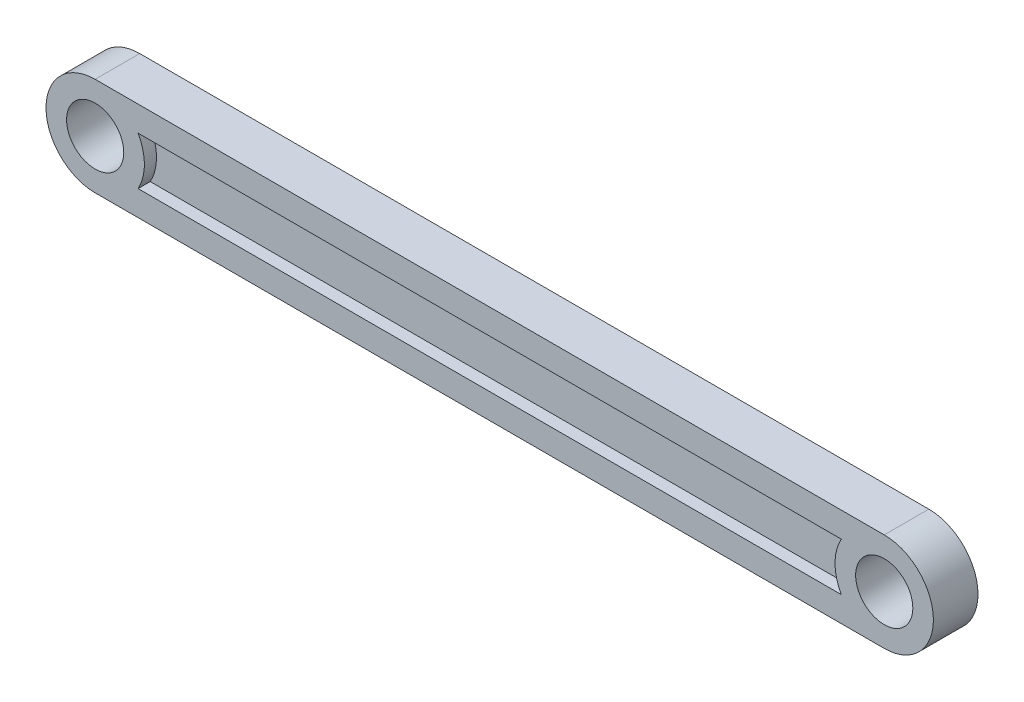
from build123d import *

# Parameters (mm, degrees)
SKETCH1_R           = 2.5
BOSS_EXTRUDE1_DEPTH = 1.95
CUT_EXTRUDE1_DEPTH  = 1.06


with BuildPart() as part:
    # Sketch1 → Boss-Extrude1 (new, symmetric)
    with BuildSketch(Plane.XY):
        with BuildLine():
            Line((34.5, -4.3), (-34.5, -4.3))
            ThreePointArc((-34.5, -4.3), (-38.8, 0), (-34.5, 4.3))
            Line((-34.5, 4.3), (34.5, 4.3))
            ThreePointArc((34.5, 4.3), (38.8, 0), (34.5, -4.3))
        make_face()
        with Locations((-34.5, 0)):
            Circle(SKETCH1_R, mode=Mode.SUBTRACT)
        with Locations((34.5, 0)):
            Circle(SKETCH1_R, mode=Mode.SUBTRACT)
    extrude(amount=BOSS_EXTRUDE1_DEPTH, both=True)

    # Sketch2 → Cut-Extrude1 (cut)
    with BuildSketch(Plane.XY.offset(1.95)):
        with BuildLine():
            ThreePointArc((30.747667392, -2.1), (30.2, 0), (30.747667392, 2.1))
            Line((30.747667392, 2.1), (-30.747667392, 2.1))
            ThreePointArc((-30.747667392, 2.1), (-30.33916894, 1.08511976), (-30.2, 0))
            ThreePointArc((-30.2, 0), (-30.33916894, -1.08511976), (-30.747667392, -2.1))
            Line((-30.747667392, -2.1), (30.747667392, -2.1))
        make_face()
    cut_extrude1 = extrude(amount=-CUT_EXTRUDE1_DEPTH, mode=Mode.SUBTRACT)

    # Mirror1: Cut-Extrude1 across plane
    add(cut_extrude1.mirror(Plane.XY), mode=Mode.SUBTRACT)


solid = part.part
